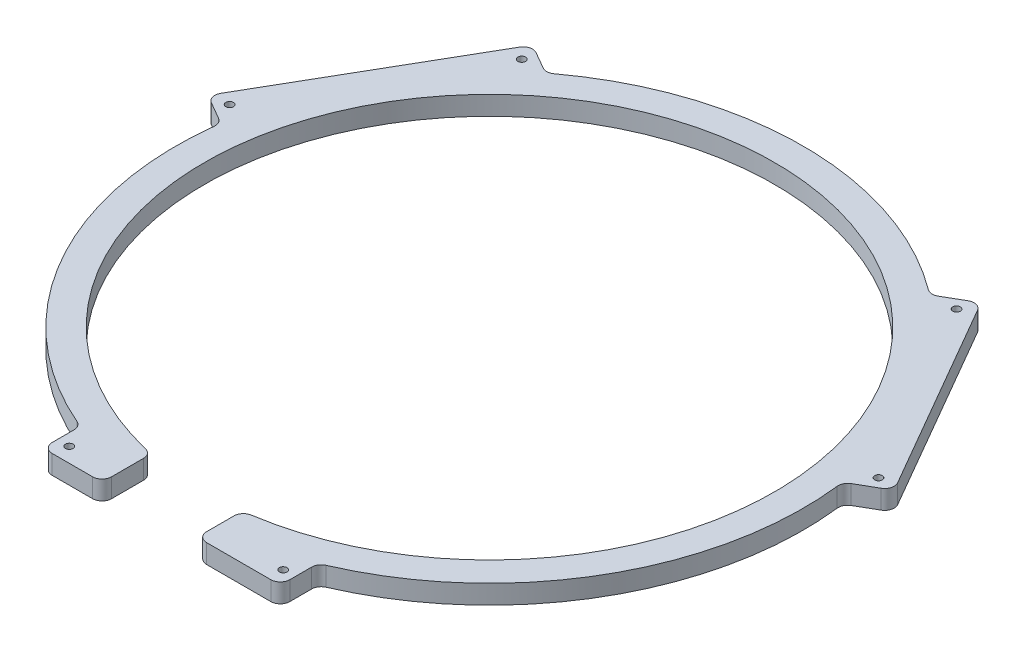
from build123d import *

# Parameters (mm, degrees)
SKETCH1_R           = 1.6
BOSS_EXTRUDE2_DEPTH = 8


with BuildPart() as part:
    # Sketch1 → Boss-Extrude2 (new body)
    with BuildSketch(Plane(origin=(0, 0, 0), x_dir=(1, 0, 0), z_dir=(0, 1, 0))):
        with BuildLine():
            Line((-75.004193667, 160.867236212), (-67.830157516, 156.725304509))
            ThreePointArc((-67.830157516, 156.725304509), (-65.599707636, 156.196050035), (-63.444946383, 156.978367686))
            ThreePointArc((-63.444946383, 156.978367686), (15.265708014, 183.014099207), (93.976880337, 156.979933523))
            ThreePointArc((93.976880337, 156.979933523), (96.133483562, 156.197553795), (98.365264281, 156.728788517))
            Line((98.365264281, 156.728788517), (106.307271021, 161.324010437))
            ThreePointArc((106.307271021, 161.324010437), (109.343075496, 161.726207543), (111.773674482, 159.863397867))
            Line((111.773674482, 159.863397867), (157.816436501, 80.200975925))
            ThreePointArc((157.816436501, 80.200975925), (158.217214787, 77.164984073), (156.353269729, 74.735255986))
            Line((156.353269729, 74.735255986), (148.364199487, 70.122764131))
            ThreePointArc((148.364199487, 70.122764131), (146.790626728, 68.45576511), (146.390753061, 66.198528301))
            ThreePointArc((146.390753061, 66.198528301), (129.583526562, -14.983904944), (67.683015931, -70.132768158))
            ThreePointArc((67.683015931, -70.132768158), (65.928218191, -71.607690224), (65.271379414, -73.803885351))
            Line((65.271379414, -73.803885351), (65.271379414, -83.002595828))
            ThreePointArc((65.271379414, -83.002595828), (64.099806539, -85.831022953), (61.271379414, -87.002595828))
            Line((61.271379414, -87.002595828), (34.271379414, -87.002595828))
            ThreePointArc((34.271379414, -87.002595828), (31.44295229, -85.831022953), (30.271379414, -83.002595828))
            Line((30.271379414, -83.002595828), (30.271379414, -71.520933984))
            ThreePointArc((30.271379414, -71.520933984), (31.233931861, -68.918259905), (33.658335594, -67.568190978))
            ThreePointArc((33.658335594, -67.568190978), (20.194853463, 170.912875133), (-12.793277309, -65.659032482))
            ThreePointArc((-12.793277309, -65.659032482), (-10.586855707, -67.072391843), (-9.728620586, -69.548136872))
            Line((-9.728620586, -69.548136872), (-9.728620586, -83.002595828))
            ThreePointArc((-9.728620586, -83.002595828), (-10.900193461, -85.831022953), (-13.728620586, -87.002595828))
            Line((-13.728620586, -87.002595828), (-30.728620586, -87.002595828))
            ThreePointArc((-30.728620586, -87.002595828), (-33.55704771, -85.831022953), (-34.728620586, -83.002595828))
            Line((-34.728620586, -83.002595828), (-34.728620586, -73.807656468))
            ThreePointArc((-34.728620586, -73.807656468), (-35.38553605, -71.611344607), (-37.140513481, -70.136428359))
            ThreePointArc((-37.140513481, -70.136428359), (-99.047180019, -14.987896579), (-115.856711089, 66.198528301))
            ThreePointArc((-115.856711089, 66.198528301), (-116.256584757, 68.45576511), (-117.830157516, 70.122764131))
            Line((-117.830157516, 70.122764131), (-125.004193667, 74.264695834))
            ThreePointArc((-125.004193667, 74.264695834), (-126.867896972, 76.693521268), (-126.468295282, 79.728797449))
            Line((-126.468295282, 79.728797449), (-80.468295282, 159.403134597))
            ThreePointArc((-80.468295282, 159.403134597), (-78.039469847, 161.266837902), (-75.004193667, 160.867236212))
        make_face()
        with Locations(Location((-75.598775183, 155.43701163, 0), (0, 0, 270))):
            Circle(SKETCH1_R, mode=Mode.SUBTRACT)
        with Locations(Location((-120.526355361, 77.452098276, 0), (0, 0, 270))):
            Circle(SKETCH1_R, mode=Mode.SUBTRACT)
        with Locations(Location((106.909257313, 155.885291293, 0), (0, 0, 270))):
            Circle(SKETCH1_R, mode=Mode.SUBTRACT)
        with Locations(Location((151.982456893, 77.984449703, 0), (0, 0, 270))):
            Circle(SKETCH1_R, mode=Mode.SUBTRACT)
        with Locations(Location((-29.728620586, -80.802595828, 0), (0, 0, 270))):
            Circle(SKETCH1_R, mode=Mode.SUBTRACT)
        with Locations(Location((60.271379414, -80.802595828, 0), (0, 0, 270))):
            Circle(SKETCH1_R, mode=Mode.SUBTRACT)
    extrude(amount=BOSS_EXTRUDE2_DEPTH)


solid = part.part
